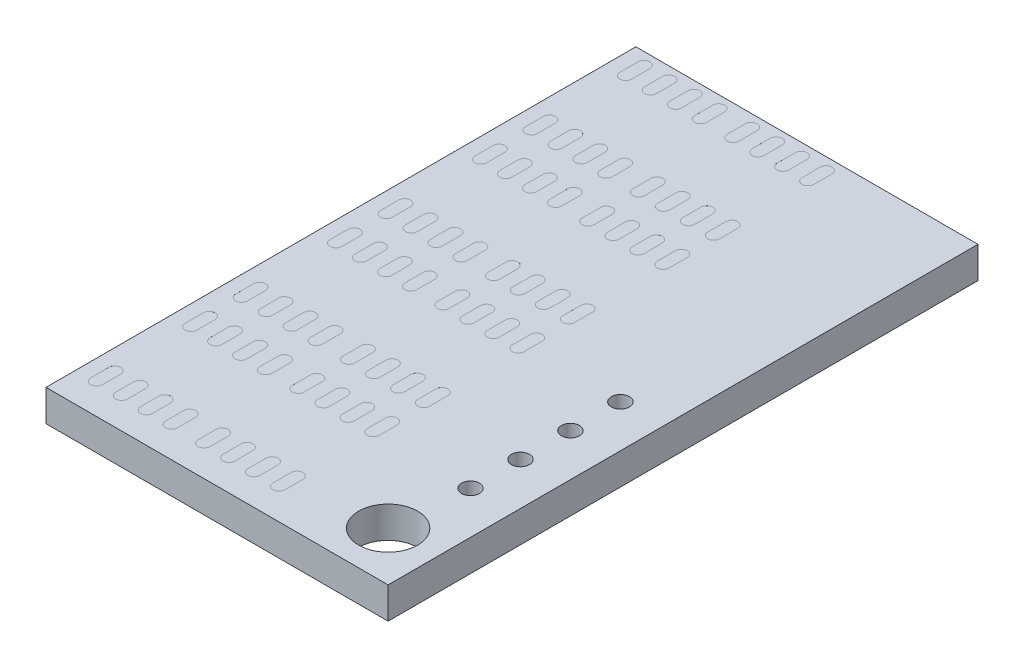
from build123d import *

# Parameters (mm, degrees)
SKETCH_1_W          = 17.4
SKETCH_1_H          = 30
EXTRUDE_1_DEPTH     = 1.6
SKETCH_2_R          = 1.5
SKETCH_2_R_2        = 0.457
CUT_EXTRUDE_1_DEPTH = 1.6
CUT_EXTRUDE_2_DEPTH = 0.0001


with BuildPart() as part:
    # Эскиз1 → Бобышка-Вытянуть1 (new body)
    with BuildSketch(Plane(origin=(0, 0, 0), x_dir=(1, 0, 0), z_dir=(0, 1, 0))):
        Rectangle(SKETCH_1_W, SKETCH_1_H)
    extrude(amount=EXTRUDE_1_DEPTH)

    # Эскиз2 → Вырез-Вытянуть1 (cut)
    with BuildSketch(Plane(origin=(0, 1.6, 0), x_dir=(1, 0, 0), z_dir=(0, 1, 0))):
        with Locations(Location((6.2, -12.5, 0), (0, 0, 270))):
            Circle(SKETCH_2_R)
        with Locations(Location((6.541, -1.03, 0), (0, 0, 270))):
            Circle(SKETCH_2_R_2)
        with Locations(Location((6.541, -3.57, 0), (0, 0, 270))):
            Circle(SKETCH_2_R_2)
        with Locations(Location((6.541, -6.11, 0), (0, 0, 270))):
            Circle(SKETCH_2_R_2)
        with Locations(Location((6.541, -8.65, 0), (0, 0, 270))):
            Circle(SKETCH_2_R_2)
    extrude(amount=-CUT_EXTRUDE_1_DEPTH, mode=Mode.SUBTRACT)

    # Эскиз3 → Вырез-Вытянуть2 (cut)
    with BuildSketch(Plane(origin=(0, 1.6, 0), x_dir=(1, 0, 0), z_dir=(0, 1, 0))):
        with BuildLine():
            Line((-7.384, 14.39), (-7.384, 13.47))
            ThreePointArc((-7.384, 13.47), (-7.684, 13.17), (-7.984, 13.47))
            Line((-7.984, 13.47), (-7.984, 14.39))
            ThreePointArc((-7.984, 14.39), (-7.684, 14.69), (-7.384, 14.39))
        make_face()
        with BuildLine():
            Line((-6.114, 14.39), (-6.114, 13.47))
            ThreePointArc((-6.114, 13.47), (-6.414, 13.17), (-6.714, 13.47))
            Line((-6.714, 13.47), (-6.714, 14.39))
            ThreePointArc((-6.714, 14.39), (-6.414, 14.69), (-6.114, 14.39))
        make_face()
        with BuildLine():
            Line((-4.844, 14.39), (-4.844, 13.47))
            ThreePointArc((-4.844, 13.47), (-5.144, 13.17), (-5.444, 13.47))
            Line((-5.444, 13.47), (-5.444, 14.39))
            ThreePointArc((-5.444, 14.39), (-5.144, 14.69), (-4.844, 14.39))
        make_face()
        with BuildLine():
            Line((-3.574, 14.39), (-3.574, 13.47))
            ThreePointArc((-3.574, 13.47), (-3.874, 13.17), (-4.174, 13.47))
            Line((-4.174, 13.47), (-4.174, 14.39))
            ThreePointArc((-4.174, 14.39), (-3.874, 14.69), (-3.574, 14.39))
        make_face()
        with BuildLine():
            Line((-6.114, 9.59), (-6.114, 8.67))
            ThreePointArc((-6.114, 8.67), (-6.414, 8.37), (-6.714, 8.67))
            Line((-6.714, 8.67), (-6.714, 9.59))
            ThreePointArc((-6.714, 9.59), (-6.414, 9.89), (-6.114, 9.59))
        make_face()
        with BuildLine():
            Line((-4.844, 9.59), (-4.844, 8.67))
            ThreePointArc((-4.844, 8.67), (-5.144, 8.37), (-5.444, 8.67))
            Line((-5.444, 8.67), (-5.444, 9.59))
            ThreePointArc((-5.444, 9.59), (-5.144, 9.89), (-4.844, 9.59))
        make_face()
        with BuildLine():
            Line((-3.574, 9.59), (-3.574, 8.67))
            ThreePointArc((-3.574, 8.67), (-3.874, 8.37), (-4.174, 8.67))
            Line((-4.174, 8.67), (-4.174, 9.59))
            ThreePointArc((-4.174, 9.59), (-3.874, 9.89), (-3.574, 9.59))
        make_face()
        with BuildLine():
            Line((-7.384, 9.59), (-7.384, 8.67))
            ThreePointArc((-7.384, 8.67), (-7.684, 8.37), (-7.984, 8.67))
            Line((-7.984, 8.67), (-7.984, 9.59))
            ThreePointArc((-7.984, 9.59), (-7.684, 9.89), (-7.384, 9.59))
        make_face()
        with BuildLine():
            Line((-1.924, 14.39), (-1.924, 13.47))
            ThreePointArc((-1.924, 13.47), (-2.224, 13.17), (-2.524, 13.47))
            Line((-2.524, 13.47), (-2.524, 14.39))
            ThreePointArc((-2.524, 14.39), (-2.224, 14.69), (-1.924, 14.39))
        make_face()
        with BuildLine():
            Line((-0.654, 14.39), (-0.654, 13.47))
            ThreePointArc((-0.654, 13.47), (-0.954, 13.17), (-1.254, 13.47))
            Line((-1.254, 13.47), (-1.254, 14.39))
            ThreePointArc((-1.254, 14.39), (-0.954, 14.69), (-0.654, 14.39))
        make_face()
        with BuildLine():
            Line((0.616, 14.39), (0.616, 13.47))
            ThreePointArc((0.616, 13.47), (0.316, 13.17), (0.016, 13.47))
            Line((0.016, 13.47), (0.016, 14.39))
            ThreePointArc((0.016, 14.39), (0.316, 14.69), (0.616, 14.39))
        make_face()
        with BuildLine():
            Line((1.886, 14.39), (1.886, 13.47))
            ThreePointArc((1.886, 13.47), (1.586, 13.17), (1.286, 13.47))
            Line((1.286, 13.47), (1.286, 14.39))
            ThreePointArc((1.286, 14.39), (1.586, 14.69), (1.886, 14.39))
        make_face()
        with BuildLine():
            Line((-0.654, 9.59), (-0.654, 8.67))
            ThreePointArc((-0.654, 8.67), (-0.954, 8.37), (-1.254, 8.67))
            Line((-1.254, 8.67), (-1.254, 9.59))
            ThreePointArc((-1.254, 9.59), (-0.954, 9.89), (-0.654, 9.59))
        make_face()
        with BuildLine():
            Line((0.616, 9.59), (0.616, 8.67))
            ThreePointArc((0.616, 8.67), (0.316, 8.37), (0.016, 8.67))
            Line((0.016, 8.67), (0.016, 9.59))
            ThreePointArc((0.016, 9.59), (0.316, 9.89), (0.616, 9.59))
        make_face()
        with BuildLine():
            Line((1.886, 9.59), (1.886, 8.67))
            ThreePointArc((1.886, 8.67), (1.586, 8.37), (1.286, 8.67))
            Line((1.286, 8.67), (1.286, 9.59))
            ThreePointArc((1.286, 9.59), (1.586, 9.89), (1.886, 9.59))
        make_face()
        with BuildLine():
            Line((-1.924, 9.59), (-1.924, 8.67))
            ThreePointArc((-1.924, 8.67), (-2.224, 8.37), (-2.524, 8.67))
            Line((-2.524, 8.67), (-2.524, 9.59))
            ThreePointArc((-2.524, 9.59), (-2.224, 9.89), (-1.924, 9.59))
        make_face()
        with BuildLine():
            Line((-1.924, 7.02), (-1.924, 6.1))
            ThreePointArc((-1.924, 6.1), (-2.224, 5.8), (-2.524, 6.1))
            Line((-2.524, 6.1), (-2.524, 7.02))
            ThreePointArc((-2.524, 7.02), (-2.224, 7.32), (-1.924, 7.02))
        make_face()
        with BuildLine():
            Line((-0.654, 7.02), (-0.654, 6.1))
            ThreePointArc((-0.654, 6.1), (-0.954, 5.8), (-1.254, 6.1))
            Line((-1.254, 6.1), (-1.254, 7.02))
            ThreePointArc((-1.254, 7.02), (-0.954, 7.32), (-0.654, 7.02))
        make_face()
        with BuildLine():
            Line((0.616, 7.02), (0.616, 6.1))
            ThreePointArc((0.616, 6.1), (0.316, 5.8), (0.016, 6.1))
            Line((0.016, 6.1), (0.016, 7.02))
            ThreePointArc((0.016, 7.02), (0.316, 7.32), (0.616, 7.02))
        make_face()
        with BuildLine():
            Line((1.886, 7.02), (1.886, 6.1))
            ThreePointArc((1.886, 6.1), (1.586, 5.8), (1.286, 6.1))
            Line((1.286, 6.1), (1.286, 7.02))
            ThreePointArc((1.286, 7.02), (1.586, 7.32), (1.886, 7.02))
        make_face()
        with BuildLine():
            Line((-0.654, 2.22), (-0.654, 1.3))
            ThreePointArc((-0.654, 1.3), (-0.954, 1), (-1.254, 1.3))
            Line((-1.254, 1.3), (-1.254, 2.22))
            ThreePointArc((-1.254, 2.22), (-0.954, 2.52), (-0.654, 2.22))
        make_face()
        with BuildLine():
            Line((0.616, 2.22), (0.616, 1.3))
            ThreePointArc((0.616, 1.3), (0.316, 1), (0.016, 1.3))
            Line((0.016, 1.3), (0.016, 2.22))
            ThreePointArc((0.016, 2.22), (0.316, 2.52), (0.616, 2.22))
        make_face()
        with BuildLine():
            Line((1.886, 2.22), (1.886, 1.3))
            ThreePointArc((1.886, 1.3), (1.586, 1), (1.286, 1.3))
            Line((1.286, 1.3), (1.286, 2.22))
            ThreePointArc((1.286, 2.22), (1.586, 2.52), (1.886, 2.22))
        make_face()
        with BuildLine():
            Line((-1.924, 2.22), (-1.924, 1.3))
            ThreePointArc((-1.924, 1.3), (-2.224, 1), (-2.524, 1.3))
            Line((-2.524, 1.3), (-2.524, 2.22))
            ThreePointArc((-2.524, 2.22), (-2.224, 2.52), (-1.924, 2.22))
        make_face()
        with BuildLine():
            Line((-1.924, -0.35), (-1.924, -1.27))
            ThreePointArc((-1.924, -1.27), (-2.224, -1.57), (-2.524, -1.27))
            Line((-2.524, -1.27), (-2.524, -0.35))
            ThreePointArc((-2.524, -0.35), (-2.224, -0.05), (-1.924, -0.35))
        make_face()
        with BuildLine():
            Line((-0.654, -0.35), (-0.654, -1.27))
            ThreePointArc((-0.654, -1.27), (-0.954, -1.57), (-1.254, -1.27))
            Line((-1.254, -1.27), (-1.254, -0.35))
            ThreePointArc((-1.254, -0.35), (-0.954, -0.05), (-0.654, -0.35))
        make_face()
        with BuildLine():
            Line((0.616, -0.35), (0.616, -1.27))
            ThreePointArc((0.616, -1.27), (0.316, -1.57), (0.016, -1.27))
            Line((0.016, -1.27), (0.016, -0.35))
            ThreePointArc((0.016, -0.35), (0.316, -0.05), (0.616, -0.35))
        make_face()
        with BuildLine():
            Line((1.886, -0.35), (1.886, -1.27))
            ThreePointArc((1.886, -1.27), (1.586, -1.57), (1.286, -1.27))
            Line((1.286, -1.27), (1.286, -0.35))
            ThreePointArc((1.286, -0.35), (1.586, -0.05), (1.886, -0.35))
        make_face()
        with BuildLine():
            Line((-0.654, -5.15), (-0.654, -6.07))
            ThreePointArc((-0.654, -6.07), (-0.954, -6.37), (-1.254, -6.07))
            Line((-1.254, -6.07), (-1.254, -5.15))
            ThreePointArc((-1.254, -5.15), (-0.954, -4.85), (-0.654, -5.15))
        make_face()
        with BuildLine():
            Line((0.616, -5.15), (0.616, -6.07))
            ThreePointArc((0.616, -6.07), (0.316, -6.37), (0.016, -6.07))
            Line((0.016, -6.07), (0.016, -5.15))
            ThreePointArc((0.016, -5.15), (0.316, -4.85), (0.616, -5.15))
        make_face()
        with BuildLine():
            Line((1.886, -5.15), (1.886, -6.07))
            ThreePointArc((1.886, -6.07), (1.586, -6.37), (1.286, -6.07))
            Line((1.286, -6.07), (1.286, -5.15))
            ThreePointArc((1.286, -5.15), (1.586, -4.85), (1.886, -5.15))
        make_face()
        with BuildLine():
            Line((-1.924, -5.15), (-1.924, -6.07))
            ThreePointArc((-1.924, -6.07), (-2.224, -6.37), (-2.524, -6.07))
            Line((-2.524, -6.07), (-2.524, -5.15))
            ThreePointArc((-2.524, -5.15), (-2.224, -4.85), (-1.924, -5.15))
        make_face()
        with BuildLine():
            Line((-1.924, -7.72), (-1.924, -8.64))
            ThreePointArc((-1.924, -8.64), (-2.224, -8.94), (-2.524, -8.64))
            Line((-2.524, -8.64), (-2.524, -7.72))
            ThreePointArc((-2.524, -7.72), (-2.224, -7.42), (-1.924, -7.72))
        make_face()
        with BuildLine():
            Line((-0.654, -7.72), (-0.654, -8.64))
            ThreePointArc((-0.654, -8.64), (-0.954, -8.94), (-1.254, -8.64))
            Line((-1.254, -8.64), (-1.254, -7.72))
            ThreePointArc((-1.254, -7.72), (-0.954, -7.42), (-0.654, -7.72))
        make_face()
        with BuildLine():
            Line((0.616, -7.72), (0.616, -8.64))
            ThreePointArc((0.616, -8.64), (0.316, -8.94), (0.016, -8.64))
            Line((0.016, -8.64), (0.016, -7.72))
            ThreePointArc((0.016, -7.72), (0.316, -7.42), (0.616, -7.72))
        make_face()
        with BuildLine():
            Line((1.886, -7.72), (1.886, -8.64))
            ThreePointArc((1.886, -8.64), (1.586, -8.94), (1.286, -8.64))
            Line((1.286, -8.64), (1.286, -7.72))
            ThreePointArc((1.286, -7.72), (1.586, -7.42), (1.886, -7.72))
        make_face()
        with BuildLine():
            Line((-0.654, -12.52), (-0.654, -13.44))
            ThreePointArc((-0.654, -13.44), (-0.954, -13.74), (-1.254, -13.44))
            Line((-1.254, -13.44), (-1.254, -12.52))
            ThreePointArc((-1.254, -12.52), (-0.954, -12.22), (-0.654, -12.52))
        make_face()
        with BuildLine():
            Line((0.616, -12.52), (0.616, -13.44))
            ThreePointArc((0.616, -13.44), (0.316, -13.74), (0.016, -13.44))
            Line((0.016, -13.44), (0.016, -12.52))
            ThreePointArc((0.016, -12.52), (0.316, -12.22), (0.616, -12.52))
        make_face()
        with BuildLine():
            Line((1.886, -12.52), (1.886, -13.44))
            ThreePointArc((1.886, -13.44), (1.586, -13.74), (1.286, -13.44))
            Line((1.286, -13.44), (1.286, -12.52))
            ThreePointArc((1.286, -12.52), (1.586, -12.22), (1.886, -12.52))
        make_face()
        with BuildLine():
            Line((-1.924, -12.52), (-1.924, -13.44))
            ThreePointArc((-1.924, -13.44), (-2.224, -13.74), (-2.524, -13.44))
            Line((-2.524, -13.44), (-2.524, -12.52))
            ThreePointArc((-2.524, -12.52), (-2.224, -12.22), (-1.924, -12.52))
        make_face()
        with BuildLine():
            Line((-7.384, 7.02), (-7.384, 6.1))
            ThreePointArc((-7.384, 6.1), (-7.684, 5.8), (-7.984, 6.1))
            Line((-7.984, 6.1), (-7.984, 7.02))
            ThreePointArc((-7.984, 7.02), (-7.684, 7.32), (-7.384, 7.02))
        make_face()
        with BuildLine():
            Line((-6.114, 7.02), (-6.114, 6.1))
            ThreePointArc((-6.114, 6.1), (-6.414, 5.8), (-6.714, 6.1))
            Line((-6.714, 6.1), (-6.714, 7.02))
            ThreePointArc((-6.714, 7.02), (-6.414, 7.32), (-6.114, 7.02))
        make_face()
        with BuildLine():
            Line((-4.844, 7.02), (-4.844, 6.1))
            ThreePointArc((-4.844, 6.1), (-5.144, 5.8), (-5.444, 6.1))
            Line((-5.444, 6.1), (-5.444, 7.02))
            ThreePointArc((-5.444, 7.02), (-5.144, 7.32), (-4.844, 7.02))
        make_face()
        with BuildLine():
            Line((-3.574, 7.02), (-3.574, 6.1))
            ThreePointArc((-3.574, 6.1), (-3.874, 5.8), (-4.174, 6.1))
            Line((-4.174, 6.1), (-4.174, 7.02))
            ThreePointArc((-4.174, 7.02), (-3.874, 7.32), (-3.574, 7.02))
        make_face()
        with BuildLine():
            Line((-6.114, 2.22), (-6.114, 1.3))
            ThreePointArc((-6.114, 1.3), (-6.414, 1), (-6.714, 1.3))
            Line((-6.714, 1.3), (-6.714, 2.22))
            ThreePointArc((-6.714, 2.22), (-6.414, 2.52), (-6.114, 2.22))
        make_face()
        with BuildLine():
            Line((-4.844, 2.22), (-4.844, 1.3))
            ThreePointArc((-4.844, 1.3), (-5.144, 1), (-5.444, 1.3))
            Line((-5.444, 1.3), (-5.444, 2.22))
            ThreePointArc((-5.444, 2.22), (-5.144, 2.52), (-4.844, 2.22))
        make_face()
        with BuildLine():
            Line((-3.574, 2.22), (-3.574, 1.3))
            ThreePointArc((-3.574, 1.3), (-3.874, 1), (-4.174, 1.3))
            Line((-4.174, 1.3), (-4.174, 2.22))
            ThreePointArc((-4.174, 2.22), (-3.874, 2.52), (-3.574, 2.22))
        make_face()
        with BuildLine():
            Line((-7.384, 2.22), (-7.384, 1.3))
            ThreePointArc((-7.384, 1.3), (-7.684, 1), (-7.984, 1.3))
            Line((-7.984, 1.3), (-7.984, 2.22))
            ThreePointArc((-7.984, 2.22), (-7.684, 2.52), (-7.384, 2.22))
        make_face()
        with BuildLine():
            Line((-7.384, -0.35), (-7.384, -1.27))
            ThreePointArc((-7.384, -1.27), (-7.684, -1.57), (-7.984, -1.27))
            Line((-7.984, -1.27), (-7.984, -0.35))
            ThreePointArc((-7.984, -0.35), (-7.684, -0.05), (-7.384, -0.35))
        make_face()
        with BuildLine():
            Line((-6.114, -0.35), (-6.114, -1.27))
            ThreePointArc((-6.114, -1.27), (-6.414, -1.57), (-6.714, -1.27))
            Line((-6.714, -1.27), (-6.714, -0.35))
            ThreePointArc((-6.714, -0.35), (-6.414, -0.05), (-6.114, -0.35))
        make_face()
        with BuildLine():
            Line((-4.844, -0.35), (-4.844, -1.27))
            ThreePointArc((-4.844, -1.27), (-5.144, -1.57), (-5.444, -1.27))
            Line((-5.444, -1.27), (-5.444, -0.35))
            ThreePointArc((-5.444, -0.35), (-5.144, -0.05), (-4.844, -0.35))
        make_face()
        with BuildLine():
            Line((-3.574, -0.35), (-3.574, -1.27))
            ThreePointArc((-3.574, -1.27), (-3.874, -1.57), (-4.174, -1.27))
            Line((-4.174, -1.27), (-4.174, -0.35))
            ThreePointArc((-4.174, -0.35), (-3.874, -0.05), (-3.574, -0.35))
        make_face()
        with BuildLine():
            Line((-6.114, -5.15), (-6.114, -6.07))
            ThreePointArc((-6.114, -6.07), (-6.414, -6.37), (-6.714, -6.07))
            Line((-6.714, -6.07), (-6.714, -5.15))
            ThreePointArc((-6.714, -5.15), (-6.414, -4.85), (-6.114, -5.15))
        make_face()
        with BuildLine():
            Line((-4.844, -5.15), (-4.844, -6.07))
            ThreePointArc((-4.844, -6.07), (-5.144, -6.37), (-5.444, -6.07))
            Line((-5.444, -6.07), (-5.444, -5.15))
            ThreePointArc((-5.444, -5.15), (-5.144, -4.85), (-4.844, -5.15))
        make_face()
        with BuildLine():
            Line((-3.574, -5.15), (-3.574, -6.07))
            ThreePointArc((-3.574, -6.07), (-3.874, -6.37), (-4.174, -6.07))
            Line((-4.174, -6.07), (-4.174, -5.15))
            ThreePointArc((-4.174, -5.15), (-3.874, -4.85), (-3.574, -5.15))
        make_face()
        with BuildLine():
            Line((-7.384, -5.15), (-7.384, -6.07))
            ThreePointArc((-7.384, -6.07), (-7.684, -6.37), (-7.984, -6.07))
            Line((-7.984, -6.07), (-7.984, -5.15))
            ThreePointArc((-7.984, -5.15), (-7.684, -4.85), (-7.384, -5.15))
        make_face()
        with BuildLine():
            Line((-7.384, -7.72), (-7.384, -8.64))
            ThreePointArc((-7.384, -8.64), (-7.684, -8.94), (-7.984, -8.64))
            Line((-7.984, -8.64), (-7.984, -7.72))
            ThreePointArc((-7.984, -7.72), (-7.684, -7.42), (-7.384, -7.72))
        make_face()
        with BuildLine():
            Line((-6.114, -7.72), (-6.114, -8.64))
            ThreePointArc((-6.114, -8.64), (-6.414, -8.94), (-6.714, -8.64))
            Line((-6.714, -8.64), (-6.714, -7.72))
            ThreePointArc((-6.714, -7.72), (-6.414, -7.42), (-6.114, -7.72))
        make_face()
        with BuildLine():
            Line((-4.844, -7.72), (-4.844, -8.64))
            ThreePointArc((-4.844, -8.64), (-5.144, -8.94), (-5.444, -8.64))
            Line((-5.444, -8.64), (-5.444, -7.72))
            ThreePointArc((-5.444, -7.72), (-5.144, -7.42), (-4.844, -7.72))
        make_face()
        with BuildLine():
            Line((-3.574, -7.72), (-3.574, -8.64))
            ThreePointArc((-3.574, -8.64), (-3.874, -8.94), (-4.174, -8.64))
            Line((-4.174, -8.64), (-4.174, -7.72))
            ThreePointArc((-4.174, -7.72), (-3.874, -7.42), (-3.574, -7.72))
        make_face()
        with BuildLine():
            Line((-6.114, -12.52), (-6.114, -13.44))
            ThreePointArc((-6.114, -13.44), (-6.414, -13.74), (-6.714, -13.44))
            Line((-6.714, -13.44), (-6.714, -12.52))
            ThreePointArc((-6.714, -12.52), (-6.414, -12.22), (-6.114, -12.52))
        make_face()
        with BuildLine():
            Line((-4.844, -12.52), (-4.844, -13.44))
            ThreePointArc((-4.844, -13.44), (-5.144, -13.74), (-5.444, -13.44))
            Line((-5.444, -13.44), (-5.444, -12.52))
            ThreePointArc((-5.444, -12.52), (-5.144, -12.22), (-4.844, -12.52))
        make_face()
        with BuildLine():
            Line((-3.574, -12.52), (-3.574, -13.44))
            ThreePointArc((-3.574, -13.44), (-3.874, -13.74), (-4.174, -13.44))
            Line((-4.174, -13.44), (-4.174, -12.52))
            ThreePointArc((-4.174, -12.52), (-3.874, -12.22), (-3.574, -12.52))
        make_face()
        with BuildLine():
            Line((-7.384, -12.52), (-7.384, -13.44))
            ThreePointArc((-7.384, -13.44), (-7.684, -13.74), (-7.984, -13.44))
            Line((-7.984, -13.44), (-7.984, -12.52))
            ThreePointArc((-7.984, -12.52), (-7.684, -12.22), (-7.384, -12.52))
        make_face()
    extrude(amount=-CUT_EXTRUDE_2_DEPTH, mode=Mode.SUBTRACT)


solid = part.part
